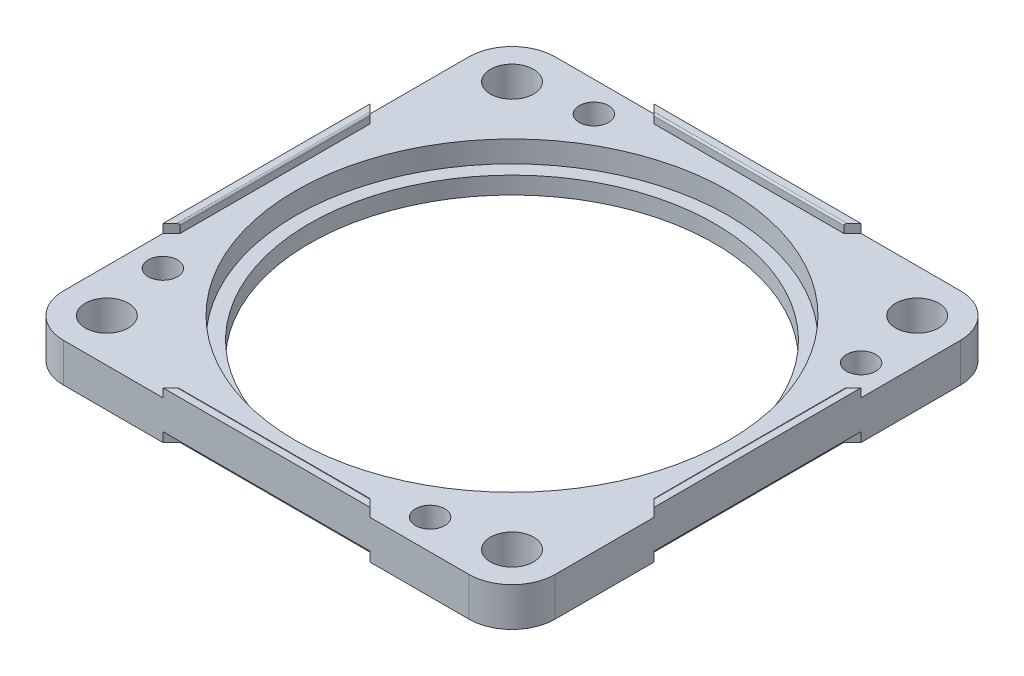
from build123d import *

# Parameters (mm, degrees)
SKETCH2_W                = 57
SKETCH2_H                = 57
SKETCH2_R                = 25.1
BOSS_EXTRUDE1_DEPTH      = 4.5
SKETCH2_3_R              = 25.1
SKETCH2_3_R_2            = 23.5
BOSS_EXTRUDE2_DEPTH      = 2
FILLET1_R                = 5
SKETCH4_R                = 2.5
SKETCH4_R_2              = 1.7
CUT_EXTRUDE1_DEPTH       = 41.555517504
BOSS_EXTRUDE3_DEPTH      = 1
FILLET2_R                = 0.2
CUT_EXTRUDE2_DEPTH       = 1.1
CIRPATTERN7_COUNT        = 4
FILLET2_OF_CIRPATTERN7_R = 0.2
FILLET3_R                = 5


with BuildPart() as part:
    # Sketch2 → Boss-Extrude1 (new body)
    with BuildSketch(Plane(origin=(0, 0, 0), x_dir=(1, 0, 0), z_dir=(0, 1, 0))):
        Rectangle(SKETCH2_W, SKETCH2_H)
        Circle(SKETCH2_R, mode=Mode.SUBTRACT)
    extrude(amount=BOSS_EXTRUDE1_DEPTH)

    # Sketch2<3> → Boss-Extrude2 (add)
    with BuildSketch(Plane(origin=(0, 0, 0), x_dir=(1, 0, 0), z_dir=(0, 1, 0))):
        Circle(SKETCH2_3_R)
        Circle(SKETCH2_3_R_2, mode=Mode.SUBTRACT)
    extrude(amount=BOSS_EXTRUDE2_DEPTH)

    # Fillet1
    fillet1_edges = [part.edges().sort_by_distance(p)[0] for p in [
        (-28.5, 2.25, -28.5),
    ]]
    fillet(fillet1_edges, radius=FILLET1_R)

    # Sketch4 → Cut-Extrude1 (cut, through all)
    with BuildSketch(Plane(origin=(0, 4.5, 0), x_dir=(1, 0, 0), z_dir=(0, 1, 0))):
        with Locations((-23.5, 23.5)):
            Circle(SKETCH4_R)
        with Locations((-15.5, 25)):
            Circle(SKETCH4_R_2)
    cut_extrude1 = extrude(amount=-CUT_EXTRUDE1_DEPTH, mode=Mode.SUBTRACT)

    # Sketch5 → Boss-Extrude3 (add)
    with BuildSketch(Plane(origin=(0, 4.5, 0), x_dir=(1, 0, 0), z_dir=(0, 1, 0))):
        Polygon((11, 27.5), (-11, 27.5), (-12, 28.5), (12, 28.5), align=None)
    boss_extrude3 = extrude(amount=BOSS_EXTRUDE3_DEPTH)

    # Fillet2
    fillet2_edges = [part.edges().sort_by_distance(p)[0] for p in [
        (0, 5.5, -27.5),
    ]]
    fillet(fillet2_edges, radius=FILLET2_R)

    # Sketch6 → Cut-Extrude2 (cut)
    with BuildSketch(Plane.XZ):
        Polygon((11, -27.5), (-11, -27.5), (-12, -28.5), (12, -28.5), align=None)
    cut_extrude2 = extrude(amount=-CUT_EXTRUDE2_DEPTH, mode=Mode.SUBTRACT)

    # CirPattern7: Cut-Extrude1, Boss-Extrude3, Cut-Extrude2 ×4 about axis
    cirpattern7_axis = Axis((0, 2, 0), (0, 1, 0))
    add([cut_extrude1.rotate(cirpattern7_axis, i * 360 / CIRPATTERN7_COUNT) for i in range(1, CIRPATTERN7_COUNT)], mode=Mode.SUBTRACT)
    add([boss_extrude3.rotate(cirpattern7_axis, i * 360 / CIRPATTERN7_COUNT) for i in range(1, CIRPATTERN7_COUNT)])
    add([cut_extrude2.rotate(cirpattern7_axis, i * 360 / CIRPATTERN7_COUNT) for i in range(1, CIRPATTERN7_COUNT)], mode=Mode.SUBTRACT)

    # Fillet2 of CirPattern7
    fillet2_of_cirpattern7_edges = [part.edges().sort_by_distance(p)[0] for p in [
        (-27.5, 5.5, 0),
        (0, 5.5, 27.5),
        (27.5, 5.5, 0),
    ]]
    fillet(fillet2_of_cirpattern7_edges, radius=FILLET2_OF_CIRPATTERN7_R)

    # Fillet3
    fillet3_edges = [part.edges().sort_by_distance(p)[0] for p in [
        (28.5, 2.25, -28.5),
        (28.5, 2.25, 28.5),
        (-28.5, 2.25, 28.5),
    ]]
    fillet(fillet3_edges, radius=FILLET3_R)


solid = part.part
